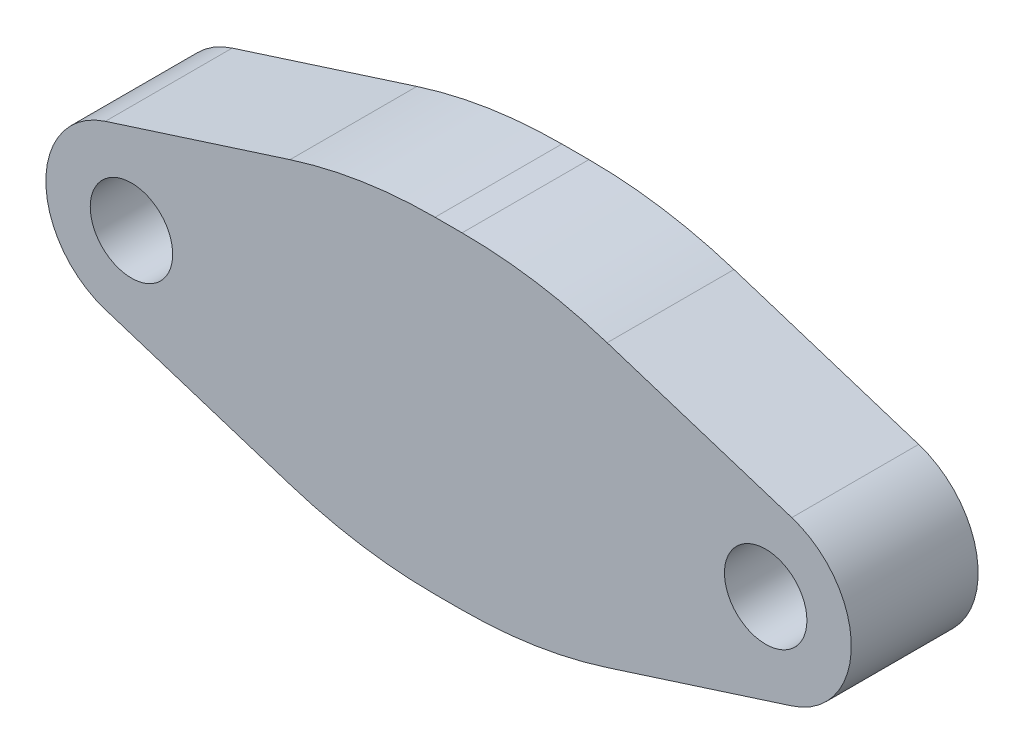
from build123d import *

# Parameters (mm, degrees)
SKETCH1_R           = 1.3
BOSS_EXTRUDE1_DEPTH = 4
SKETCH2_R           = 4.330127019
BOSS_EXTRUDE2_DEPTH = 1.2


with BuildPart() as part:
    # Sketch1 → Boss-Extrude1 (new body)
    with BuildSketch(Plane.XY):
        with BuildLine():
            Line((10.823243212, 2.571433572), (5, 4.435742065))
            ThreePointArc((5, 4.435742065), (2.74093184, 4.97035983), (0.426426599, 5.15))
            Line((0.426426599, 5.15), (-0.426426599, 5.15))
            ThreePointArc((-0.426426599, 5.15), (-2.74093184, 4.97035983), (-5, 4.435742065))
            Line((-5, 4.435742065), (-10.823243212, 2.571433572))
            ThreePointArc((-10.823243212, 2.571433572), (-12.7, 0), (-10.823243212, -2.571433572))
            Line((-10.823243212, -2.571433572), (-5, -4.435742065))
            ThreePointArc((-5, -4.435742065), (-2.74093184, -4.97035983), (-0.426426599, -5.15))
            Line((-0.426426599, -5.15), (0.426426599, -5.15))
            ThreePointArc((0.426426599, -5.15), (2.74093184, -4.97035983), (5, -4.435742065))
            Line((5, -4.435742065), (10.823243212, -2.571433572))
            ThreePointArc((10.823243212, -2.571433572), (12.7, 0), (10.823243212, 2.571433572))
        make_face()
        with Locations((10, 0)):
            Circle(SKETCH1_R, mode=Mode.SUBTRACT)
        with Locations(Location((-10, 0, 0), (0, 0, 180))):
            Circle(SKETCH1_R, mode=Mode.SUBTRACT)
        Polygon((2.165063509, 3.75), (-2.165063509, 3.75), (-4.330127019, 0), (-2.165063509, -3.75), (2.165063509, -3.75), (4.330127019, 0), align=None, mode=Mode.SUBTRACT)
    extrude(amount=BOSS_EXTRUDE1_DEPTH)

    # Sketch2 → Boss-Extrude2 (add)
    with BuildSketch(Plane.XY.offset(4)):
        Circle(SKETCH2_R)
    extrude(amount=-BOSS_EXTRUDE2_DEPTH)


solid = part.part
